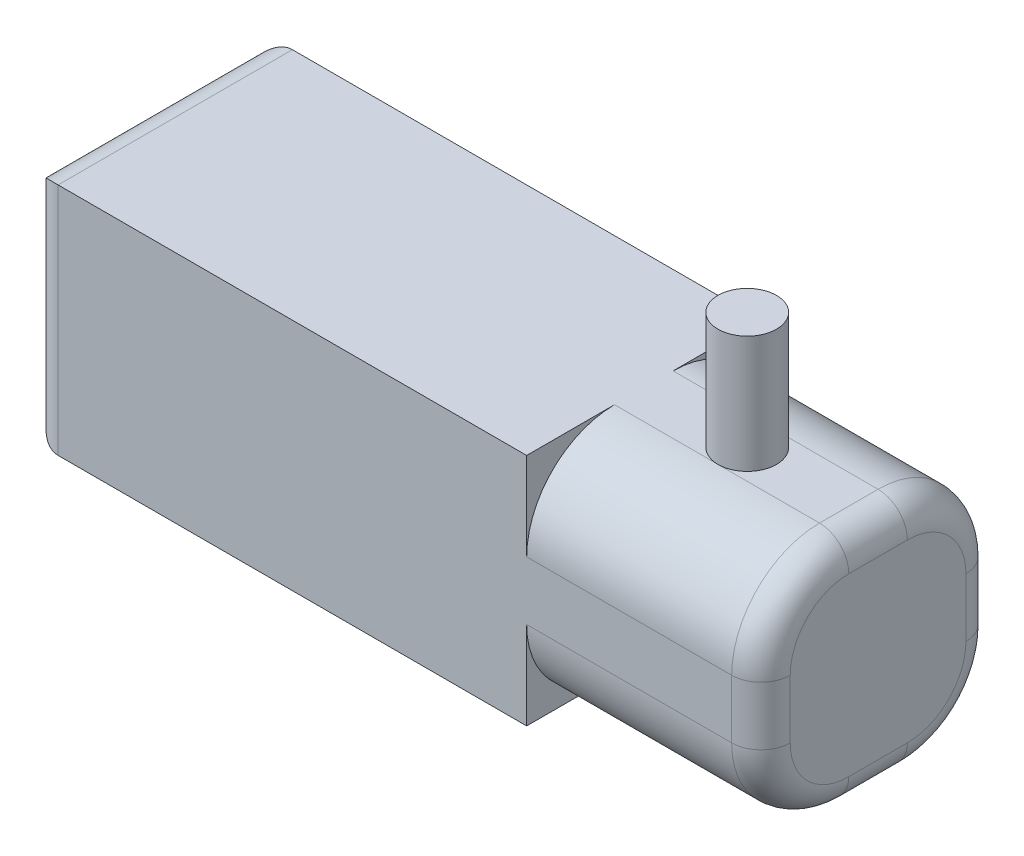
from build123d import *

# Parameters (mm, degrees)
SKETCH1_W           = 63.5
SKETCH1_H           = 20.32
BOSS_EXTRUDE1_DEPTH = 20.32
CUT_EXTRUDE2_DEPTH  = 20.32
FILLET1_R           = 2.54
SKETCH3_R           = 2.54
BOSS_EXTRUDE2_DEPTH = 15.24
FILLET2_R           = 2.54
CUT_EXTRUDE3_START  = -5.08
SKETCH4_R           = 2.54
CUT_EXTRUDE3_DEPTH  = 5.08


with BuildPart() as part:
    # Sketch1 → Boss-Extrude1 (new body)
    with BuildSketch(Plane.XY):
        Rectangle(SKETCH1_W, SKETCH1_H)
    extrude(amount=BOSS_EXTRUDE1_DEPTH)

    # Sketch2 → Cut-Extrude2 (cut)
    with BuildSketch(Plane(origin=(31.75, 0, 0), x_dir=(0, 0, -1), z_dir=(1, 0, 0))):
        with BuildLine():
            Line((-20.32, 2.54), (-20.32, 10.16))
            Line((-20.32, 10.16), (-12.7, 10.16))
            ThreePointArc((-12.7, 10.16), (-18.088153673, 7.928153673), (-20.32, 2.54))
        make_face()
        with BuildLine():
            Line((-7.62, 10.16), (0, 10.16))
            Line((0, 10.16), (0, 2.54))
            ThreePointArc((0, 2.54), (-2.231846327, 7.928153673), (-7.62, 10.16))
        make_face()
        with BuildLine():
            Line((-7.62, -10.16), (0, -10.16))
            Line((0, -10.16), (0, -2.54))
            ThreePointArc((0, -2.54), (-2.231846327, -7.928153673), (-7.62, -10.16))
        make_face()
        with BuildLine():
            Line((-12.7, -10.16), (-20.32, -10.16))
            Line((-20.32, -10.16), (-20.32, -2.54))
            ThreePointArc((-20.32, -2.54), (-18.088153673, -7.928153673), (-12.7, -10.16))
        make_face()
    extrude(amount=-CUT_EXTRUDE2_DEPTH, mode=Mode.SUBTRACT)

    # Fillet1
    fillet1_edges = [part.edges().sort_by_distance(p)[0] for p in [
        (31.75, 0, 0),
        (31.75, 0, 20.32),
        (31.75, -10.16, 10.16),
        (31.75, 10.16, 10.16),
        (31.75, -7.928153673, 18.088153673),
        (31.75, -7.928153673, 2.231846327),
        (31.75, 7.928153673, 2.231846327),
        (31.75, 7.928153673, 18.088153673),
    ]]
    fillet(fillet1_edges, radius=FILLET1_R)

    # Sketch3 → Boss-Extrude2 (add)
    with BuildSketch(Plane(origin=(0, 10.16, 0), x_dir=(1, 0, 0), z_dir=(0, 1, 0))):
        with Locations(Location((20.4017153, -10.16, 0), (0, 0, 270))):
            Circle(SKETCH3_R)
    extrude(amount=BOSS_EXTRUDE2_DEPTH)

    # Fillet2
    fillet2_edges = [part.edges().sort_by_distance(p)[0] for p in [
        (-31.75, 0, 20.32),
        (-31.75, 0, 0),
        (-31.75, -10.16, 10.16),
        (-31.75, 10.16, 10.16),
    ]]
    fillet(fillet2_edges, radius=FILLET2_R)

    # Sketch4 → Cut-Extrude3 (cut)
    with BuildSketch(Plane(origin=(0, 25.4, 0), x_dir=(1, 0, 0), z_dir=(0, 1, 0)).offset(CUT_EXTRUDE3_START)):
        with Locations(Location((20.4017153, -10.16, 0), (0, 0, 270))):
            Circle(SKETCH4_R)
    extrude(amount=CUT_EXTRUDE3_DEPTH, mode=Mode.SUBTRACT)


solid = part.part
